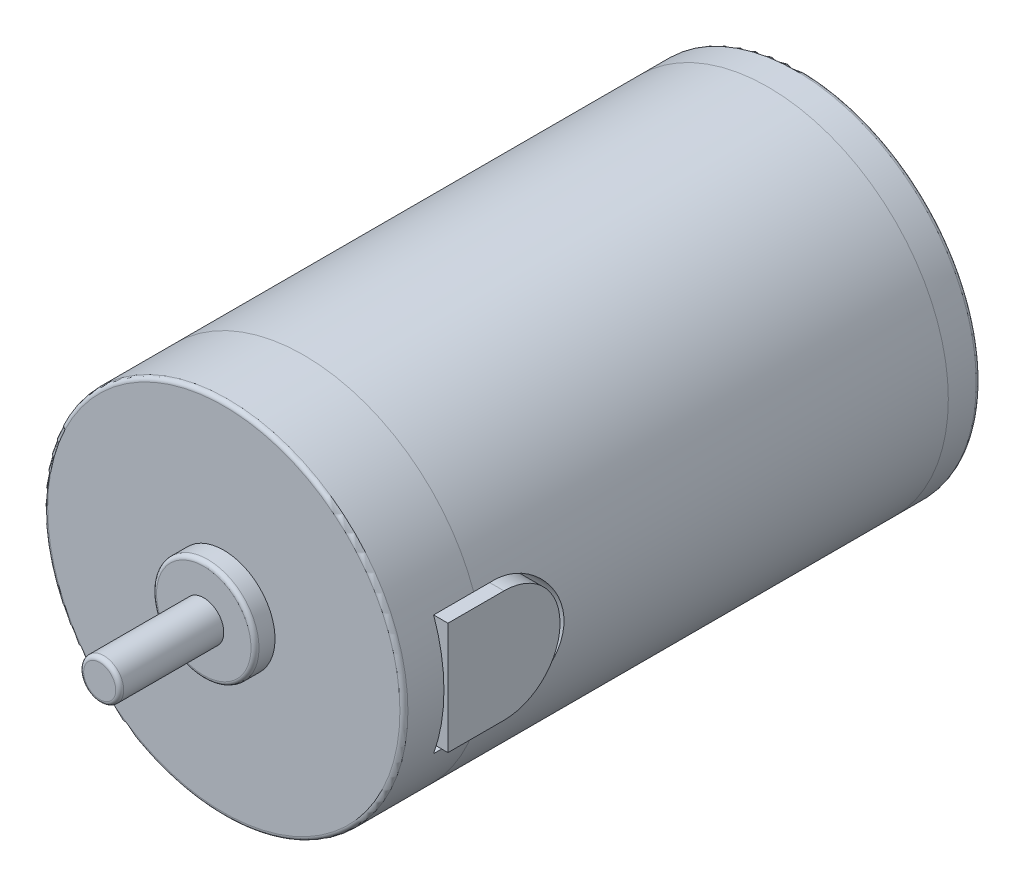
from build123d import *

# Parameters (mm, degrees)
FILLET1_R           = 0.5
CUT_EXTRUDE1_DEPTH  = 5
BOSS_EXTRUDE1_DEPTH = 5


with BuildPart() as part:
    # Sketch1 → Revolve1 (revolve)
    with BuildSketch(Plane(origin=(0, 0, 0), x_dir=(0, 0, -1), z_dir=(1, 0, 0)), mode=Mode.PRIVATE) as revolve1_sk:
        Polygon((0, 0), (0, 22.5), (-72, 22.5), (-72, 6.4), (-74.5, 6.4), (-74.5, 2.5), (-87.5, 2.5), (-87.5, 0), align=None)
    revolve(revolve1_sk.sketch.rotate(Axis((0, 0, 0), (0, 0, 1)), 90), axis=Axis((0, 0, 0), (0, 0, 1)))

    # Fillet1
    fillet1_edges = [part.edges().sort_by_distance(p)[0] for p in [
        (2.5, 0, 87.5),
        (6.4, 0, 74.5),
        (22.5, 0, 72),
        (22.5, 0, 0),
    ]]
    fillet(fillet1_edges, radius=FILLET1_R)

    # Sketch3 → Cut-Extrude1 (cut)
    with BuildSketch(Plane(origin=(22.5, 0, 0), x_dir=(0, 0, -1), z_dir=(1, 0, 0))):
        with BuildLine():
            Line((-67, -7.5), (-67, 7.5))
            Line((-67, 7.5), (-59.5, 7.5))
            ThreePointArc((-59.5, 7.5), (-52, 0), (-59.5, -7.5))
            Line((-59.5, -7.5), (-67, -7.5))
        make_face()
    cut_extrude1 = extrude(amount=-CUT_EXTRUDE1_DEPTH, mode=Mode.SUBTRACT)

    # Sketch4 → Boss-Extrude1 (add)
    with BuildSketch(Plane(origin=(17.5, 0, 0), x_dir=(0, 0, -1), z_dir=(1, 0, 0))):
        with BuildLine():
            Line((-66.5, -7), (-59.5, -7))
            ThreePointArc((-59.5, -7), (-52.5, 0), (-59.5, 7))
            Line((-59.5, 7), (-66.5, 7))
            Line((-66.5, 7), (-66.5, -7))
        make_face()
    boss_extrude1 = extrude(amount=BOSS_EXTRUDE1_DEPTH)

    # Mirror1: Cut-Extrude1, Boss-Extrude1 across plane
    add(cut_extrude1.mirror(Plane(origin=(0, 0, 0), x_dir=(0, 0, 1), z_dir=(1, 0, 0))), mode=Mode.SUBTRACT)
    add(boss_extrude1.mirror(Plane(origin=(0, 0, 0), x_dir=(0, 0, 1), z_dir=(1, 0, 0))))


solid = part.part
